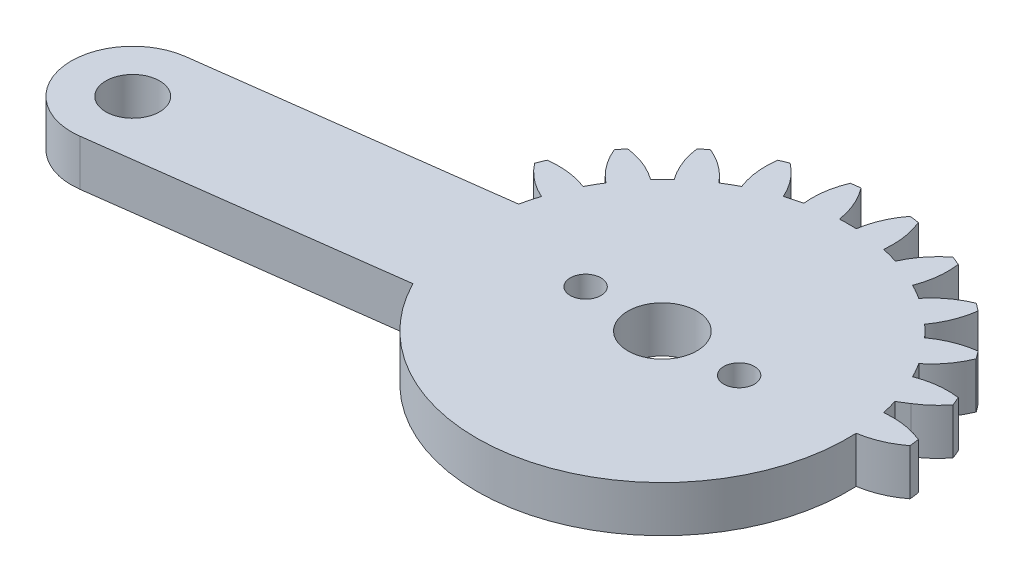
from build123d import *
from build123d.topology import SkipClean

# Parameters (mm, degrees)
SKETCH1_R           = 1.5
BOSS_EXTRUDE1_DEPTH = 3
SKETCH3_R           = 1.75
BOSS_EXTRUDE2_DEPTH = 3
CUT_EXTRUDE1_START  = -4
CUT_EXTRUDE1_DEPTH  = 4
CUT_EXTRUDE2_REACH  = 48.999
SKETCH5_R           = 1
SKETCH5_R_2         = 2.25


with BuildPart() as part:
    # Sketch1 → Boss-Extrude1 (new body)
    with BuildSketch(Plane(origin=(0, 0, 0), x_dir=(1, 0, 0), z_dir=(0, 1, 0))):
        with BuildLine():
            Line((20.643657446, 4), (2.081641936, 4))
            ThreePointArc((2.081641936, 4), (2.861028333, 4.588201733), (3.521749436, 5.30713988))
            ThreePointArc((3.521749436, 5.30713988), (3.405395609, 5.596745198), (3.282888305, 5.883801663))
            ThreePointArc((3.282888305, 5.883801663), (1.93527598, 5.894040025), (0.627094961, 5.57027124))
            ThreePointArc((0.627094961, 5.57027124), (0.366286148, 6.046375), (0.084372603, 6.510293938))
            ThreePointArc((0.084372603, 6.510293938), (1.018855105, 7.48132754), (1.683794586, 8.65351323))
            ThreePointArc((1.683794586, 8.65351323), (1.496450048, 8.903135899), (1.303821399, 9.148703928))
            ThreePointArc((1.303821399, 9.148703928), (-0.000522033, 8.809805691), (-1.180330337, 8.158486898))
            ThreePointArc((-1.180330337, 8.158486898), (-1.555477026, 8.550865528), (-1.947855656, 8.926012217))
            ThreePointArc((-1.947855656, 8.926012217), (-1.296536862, 10.105820521), (-0.957638625, 11.410163953))
            ThreePointArc((-0.957638625, 11.410163953), (-1.203206655, 11.602792602), (-1.452829324, 11.79013714))
            ThreePointArc((-1.452829324, 11.79013714), (-2.625015014, 11.125197659), (-3.596048616, 10.190715157))
            ThreePointArc((-3.596048616, 10.190715157), (-4.059967554, 10.472628702), (-4.536071314, 10.733437515))
            ThreePointArc((-4.536071314, 10.733437515), (-4.212302529, 12.041618533), (-4.222540891, 13.389230859))
            ThreePointArc((-4.222540891, 13.389230859), (-4.509597355, 13.511738163), (-4.799202674, 13.62809199))
            ThreePointArc((-4.799202674, 13.62809199), (-5.759348103, 12.682425791), (-6.455432668, 11.528463019))
            ThreePointArc((-6.455432668, 11.528463019), (-6.976508546, 11.680699536), (-7.503891752, 11.809396783))
            ThreePointArc((-7.503891752, 11.809396783), (-7.529737283, 13.156800143), (-7.888414517, 14.455843809))
            ThreePointArc((-7.888414517, 14.455843809), (-8.197396993, 14.499881098), (-8.507248835, 14.537314892))
            ThreePointArc((-8.507248835, 14.537314892), (-9.18992168, 13.375367565), (-9.563620196, 12.080565177))
            ThreePointArc((-9.563620196, 12.080565177), (-10.106342554, 12.09275), (-10.649064912, 12.080565177))
            ThreePointArc((-10.649064912, 12.080565177), (-11.022763428, 13.375367565), (-11.705436272, 14.537314892))
            ThreePointArc((-11.705436272, 14.537314892), (-12.015288115, 14.499881098), (-12.324270591, 14.455843809))
            ThreePointArc((-12.324270591, 14.455843809), (-12.682947825, 13.156800143), (-12.708793355, 11.809396783))
            ThreePointArc((-12.708793355, 11.809396783), (-13.236176561, 11.680699536), (-13.757252439, 11.528463019))
            ThreePointArc((-13.757252439, 11.528463019), (-14.453337005, 12.682425791), (-15.413482434, 13.62809199))
            ThreePointArc((-15.413482434, 13.62809199), (-15.703087752, 13.511738163), (-15.990144217, 13.389230859))
            ThreePointArc((-15.990144217, 13.389230859), (-16.000382579, 12.041618533), (-15.676613793, 10.733437515))
            ThreePointArc((-15.676613793, 10.733437515), (-16.152717554, 10.472628702), (-16.616636492, 10.190715157))
            ThreePointArc((-16.616636492, 10.190715157), (-17.587670094, 11.125197659), (-18.759855783, 11.79013714))
            ThreePointArc((-18.759855783, 11.79013714), (-19.009478453, 11.602792602), (-19.255046482, 11.410163953))
            ThreePointArc((-19.255046482, 11.410163953), (-18.916148245, 10.105820521), (-18.264829452, 8.926012217))
            ThreePointArc((-18.264829452, 8.926012217), (-18.657208082, 8.550865528), (-19.032354771, 8.158486898))
            ThreePointArc((-19.032354771, 8.158486898), (-20.212163074, 8.809805691), (-21.516506507, 9.148703928))
            ThreePointArc((-21.516506507, 9.148703928), (-21.709135156, 8.903135899), (-21.896479694, 8.65351323))
            ThreePointArc((-21.896479694, 8.65351323), (-21.231540213, 7.48132754), (-20.297057711, 6.510293938))
            ThreePointArc((-20.297057711, 6.510293938), (-20.578971255, 6.046375), (-20.839780068, 5.57027124))
            ThreePointArc((-20.839780068, 5.57027124), (-22.147961087, 5.894040025), (-23.495573413, 5.883801663))
            ThreePointArc((-23.495573413, 5.883801663), (-23.618080717, 5.596745198), (-23.734434544, 5.30713988))
            ThreePointArc((-23.734434544, 5.30713988), (-22.788768345, 4.346994451), (-21.634805572, 3.650909885))
            ThreePointArc((-21.634805572, 3.650909885), (-21.78704209, 3.129834008), (-21.915739337, 2.602450802))
            ThreePointArc((-21.915739337, 2.602450802), (-23.263142697, 2.576605271), (-24.562186363, 2.217928037))
            ThreePointArc((-24.562186363, 2.217928037), (-24.606223651, 1.908945561), (-24.643657446, 1.599093719))
            ThreePointArc((-24.643657446, 1.599093719), (-23.481710119, 0.916420874), (-22.186907731, 0.542722358))
            ThreePointArc((-22.186907731, 0.542722358), (-22.199092554, 0), (-22.186907731, -0.542722358))
            ThreePointArc((-22.186907731, -0.542722358), (-23.481710119, -0.916420874), (-24.643657446, -1.599093719))
            ThreePointArc((-24.643657446, -1.599093719), (-24.606223651, -1.908945561), (-24.562186363, -2.217928037))
            ThreePointArc((-24.562186363, -2.217928037), (-23.263142697, -2.576605271), (-21.915739337, -2.602450802))
            ThreePointArc((-21.915739337, -2.602450802), (-21.78704209, -3.129834008), (-21.634805572, -3.650909885))
            ThreePointArc((-21.634805572, -3.650909885), (-22.788768345, -4.346994451), (-23.734434544, -5.30713988))
            ThreePointArc((-23.734434544, -5.30713988), (-23.618080717, -5.596745198), (-23.495573413, -5.883801663))
            ThreePointArc((-23.495573413, -5.883801663), (-22.147961087, -5.894040025), (-20.839780068, -5.57027124))
            ThreePointArc((-20.839780068, -5.57027124), (-20.578971255, -6.046375), (-20.297057711, -6.510293938))
            ThreePointArc((-20.297057711, -6.510293938), (-21.231540213, -7.48132754), (-21.896479694, -8.65351323))
            ThreePointArc((-21.896479694, -8.65351323), (-21.709135156, -8.903135899), (-21.516506507, -9.148703928))
            ThreePointArc((-21.516506507, -9.148703928), (-20.212163074, -8.809805691), (-19.032354771, -8.158486898))
            ThreePointArc((-19.032354771, -8.158486898), (-18.657208082, -8.550865528), (-18.264829452, -8.926012217))
            ThreePointArc((-18.264829452, -8.926012217), (-18.916148245, -10.105820521), (-19.255046482, -11.410163953))
            ThreePointArc((-19.255046482, -11.410163953), (-19.009478453, -11.602792602), (-18.759855783, -11.79013714))
            ThreePointArc((-18.759855783, -11.79013714), (-17.587670094, -11.125197659), (-16.616636492, -10.190715157))
            ThreePointArc((-16.616636492, -10.190715157), (-16.152717554, -10.472628702), (-15.676613793, -10.733437515))
            ThreePointArc((-15.676613793, -10.733437515), (-16.000382579, -12.041618533), (-15.990144217, -13.389230859))
            ThreePointArc((-15.990144217, -13.389230859), (-15.703087752, -13.511738163), (-15.413482434, -13.62809199))
            ThreePointArc((-15.413482434, -13.62809199), (-14.453337005, -12.682425791), (-13.757252439, -11.528463019))
            ThreePointArc((-13.757252439, -11.528463019), (-13.236176561, -11.680699536), (-12.708793355, -11.809396783))
            ThreePointArc((-12.708793355, -11.809396783), (-12.682947825, -13.156800143), (-12.324270591, -14.455843809))
            ThreePointArc((-12.324270591, -14.455843809), (-12.015288115, -14.499881098), (-11.705436272, -14.537314892))
            ThreePointArc((-11.705436272, -14.537314892), (-11.022763428, -13.375367565), (-10.649064912, -12.080565177))
            ThreePointArc((-10.649064912, -12.080565177), (-10.106342554, -12.09275), (-9.563620196, -12.080565177))
            ThreePointArc((-9.563620196, -12.080565177), (-9.18992168, -13.375367565), (-8.507248835, -14.537314892))
            ThreePointArc((-8.507248835, -14.537314892), (-8.197396993, -14.499881098), (-7.888414517, -14.455843809))
            ThreePointArc((-7.888414517, -14.455843809), (-7.529737283, -13.156800143), (-7.503891752, -11.809396783))
            ThreePointArc((-7.503891752, -11.809396783), (-6.976508546, -11.680699536), (-6.455432668, -11.528463019))
            ThreePointArc((-6.455432668, -11.528463019), (-5.759348103, -12.682425791), (-4.799202674, -13.62809199))
            ThreePointArc((-4.799202674, -13.62809199), (-4.509597355, -13.511738163), (-4.222540891, -13.389230859))
            ThreePointArc((-4.222540891, -13.389230859), (-4.212302529, -12.041618533), (-4.536071314, -10.733437515))
            ThreePointArc((-4.536071314, -10.733437515), (-4.059967554, -10.472628702), (-3.596048616, -10.190715157))
            ThreePointArc((-3.596048616, -10.190715157), (-2.625015014, -11.125197659), (-1.452829324, -11.79013714))
            ThreePointArc((-1.452829324, -11.79013714), (-1.203206655, -11.602792602), (-0.957638625, -11.410163953))
            ThreePointArc((-0.957638625, -11.410163953), (-1.296536862, -10.105820521), (-1.947855656, -8.926012217))
            ThreePointArc((-1.947855656, -8.926012217), (-1.555477026, -8.550865528), (-1.180330337, -8.158486898))
            ThreePointArc((-1.180330337, -8.158486898), (-0.000522033, -8.809805691), (1.303821399, -9.148703928))
            ThreePointArc((1.303821399, -9.148703928), (1.496450048, -8.903135899), (1.683794586, -8.65351323))
            ThreePointArc((1.683794586, -8.65351323), (1.018855105, -7.48132754), (0.084372603, -6.510293938))
            ThreePointArc((0.084372603, -6.510293938), (0.366286148, -6.046375), (0.627094961, -5.57027124))
            ThreePointArc((0.627094961, -5.57027124), (1.93527598, -5.894040025), (3.282888305, -5.883801663))
            ThreePointArc((3.282888305, -5.883801663), (3.405395609, -5.596745198), (3.521749436, -5.30713988))
            ThreePointArc((3.521749436, -5.30713988), (2.861028333, -4.588201733), (2.081641936, -4))
            Line((2.081641936, -4), (20.643657446, -4))
            ThreePointArc((20.643657446, -4), (24.643657446, 0), (20.643657446, 4))
        make_face()
        with Locations(Location((-10.106342554, 0, 0), (0, 0, 270))):
            Circle(SKETCH1_R, mode=Mode.SUBTRACT)
        with Locations(Location((20.643657446, 0, 0), (0, 0, 270))):
            Circle(SKETCH1_R, mode=Mode.SUBTRACT)
    extrude(amount=BOSS_EXTRUDE1_DEPTH)

    # Sketch3 → Boss-Extrude2 (add)
    with BuildSketch(Plane(origin=(0, 3, 0), x_dir=(1, 0, 0), z_dir=(0, 1, 0))):
        with BuildLine():
            ThreePointArc((-9.584237785, -3.965779445), (-14.072121999, -0.522104769), (-10.628447323, 3.965779445))
            Line((-10.628447323, 3.965779445), (-41.11537681, -0.047900965))
            ThreePointArc((-41.11537681, -0.047900965), (-44.559051487, -4.53578518), (-40.071167272, -7.979459856))
            Line((-40.071167272, -7.979459856), (-9.584237785, -3.965779445))
        make_face()
        with Locations(Location((-40.593272041, -4.013680411, 0), (0, 0, 270))):
            Circle(SKETCH3_R, mode=Mode.SUBTRACT)
    extrude(amount=-BOSS_EXTRUDE2_DEPTH)

    # Sketch4 → Cut-Extrude1 (cut)
    with SkipClean():  # the faces are left unmerged after this step: merging them gives an invalid solid
        with BuildSketch(Plane(origin=(0, 3, 0), x_dir=(1, 0, 0), z_dir=(0, 1, 0)).offset(CUT_EXTRUDE1_START)):
            with BuildLine():
                ThreePointArc((20.643657446, -4), (24.643657446, 0), (20.643657446, 4))
                Line((20.643657446, 4), (2.081641936, 4))
                Line((2.081641936, 4), (1.43808022, 3.600125745))
                ThreePointArc((1.43808022, 3.600125745), (1.581217534, 3.104116905), (1.70305423, 2.602450802))
                ThreePointArc((1.70305423, 2.602450802), (3.050457589, 2.576605271), (4.349501255, 2.217928037))
                ThreePointArc((4.349501255, 2.217928037), (4.393538544, 1.908945561), (4.430972339, 1.599093719))
                ThreePointArc((4.430972339, 1.599093719), (3.269025011, 0.916420874), (1.974222624, 0.542722358))
                ThreePointArc((1.974222624, 0.542722358), (1.70305423, -2.602450802), (0.627094961, -5.57027124))
                ThreePointArc((0.627094961, -5.57027124), (1.93527598, -5.894040025), (3.282888305, -5.883801663))
                ThreePointArc((3.282888305, -5.883801663), (3.405395609, -5.596745198), (3.521749436, -5.30713988))
                ThreePointArc((3.521749436, -5.30713988), (2.861028333, -4.588201733), (2.081641936, -4))
                Line((2.081641936, -4), (20.643657446, -4))
            make_face()
            with BuildLine():
                ThreePointArc((1.683794586, -8.65351323), (1.018855105, -7.48132754), (0.084372603, -6.510293938))
                ThreePointArc((0.084372603, -6.510293938), (-0.512518948, -7.361599771), (-1.180330337, -8.158486898))
                ThreePointArc((-1.180330337, -8.158486898), (-0.000522033, -8.809805691), (1.303821399, -9.148703928))
                ThreePointArc((1.303821399, -9.148703928), (1.496450048, -8.903135899), (1.683794586, -8.65351323))
            make_face()
            with BuildLine():
                ThreePointArc((-0.957638625, -11.410163953), (-1.296536862, -10.105820521), (-1.947855656, -8.926012217))
                ThreePointArc((-1.947855656, -8.926012217), (-2.744742783, -9.593823606), (-3.596048616, -10.190715157))
                ThreePointArc((-3.596048616, -10.190715157), (-2.625015014, -11.125197659), (-1.452829324, -11.79013714))
                ThreePointArc((-1.452829324, -11.79013714), (-1.203206655, -11.602792602), (-0.957638625, -11.410163953))
            make_face()
            with BuildLine():
                ThreePointArc((-4.222540891, -13.389230859), (-4.212302529, -12.041618533), (-4.536071314, -10.733437515))
                ThreePointArc((-4.536071314, -10.733437515), (-5.478647477, -11.172244217), (-6.455432668, -11.528463019))
                ThreePointArc((-6.455432668, -11.528463019), (-5.759348103, -12.682425791), (-4.799202674, -13.62809199))
                ThreePointArc((-4.799202674, -13.62809199), (-4.509597355, -13.511738163), (-4.222540891, -13.389230859))
            make_face()
            with BuildLine():
                ThreePointArc((-7.888414517, -14.455843809), (-7.529737283, -13.156800143), (-7.503891752, -11.809396783))
                ThreePointArc((-7.503891752, -11.809396783), (-8.527921943, -11.989294847), (-9.563620196, -12.080565177))
                ThreePointArc((-9.563620196, -12.080565177), (-9.18992168, -13.375367565), (-8.507248835, -14.537314892))
                ThreePointArc((-8.507248835, -14.537314892), (-8.197396993, -14.499881098), (-7.888414517, -14.455843809))
            make_face()
            with BuildLine():
                ThreePointArc((-11.705436272, -14.537314892), (-11.022763428, -13.375367565), (-10.649064912, -12.080565177))
                ThreePointArc((-10.649064912, -12.080565177), (-11.684763165, -11.989294847), (-12.708793355, -11.809396783))
                ThreePointArc((-12.708793355, -11.809396783), (-12.682947825, -13.156800143), (-12.324270591, -14.455843809))
                ThreePointArc((-12.324270591, -14.455843809), (-12.015288115, -14.499881098), (-11.705436272, -14.537314892))
            make_face()
            with BuildLine():
                ThreePointArc((-15.413482434, -13.62809199), (-14.453337005, -12.682425791), (-13.757252439, -11.528463019))
                ThreePointArc((-13.757252439, -11.528463019), (-14.734037631, -11.172244217), (-15.676613793, -10.733437515))
                ThreePointArc((-15.676613793, -10.733437515), (-16.000382579, -12.041618533), (-15.990144217, -13.389230859))
                ThreePointArc((-15.990144217, -13.389230859), (-15.703087752, -13.511738163), (-15.413482434, -13.62809199))
            make_face()
            with BuildLine():
                ThreePointArc((-18.759855783, -11.79013714), (-17.587670094, -11.125197659), (-16.616636492, -10.190715157))
                ThreePointArc((-16.616636492, -10.190715157), (-17.467942324, -9.593823606), (-18.264829452, -8.926012217))
                ThreePointArc((-18.264829452, -8.926012217), (-18.916148245, -10.105820521), (-19.255046482, -11.410163953))
                ThreePointArc((-19.255046482, -11.410163953), (-19.009478453, -11.602792602), (-18.759855783, -11.79013714))
            make_face()
            with BuildLine():
                ThreePointArc((-21.516506507, -9.148703928), (-20.212163074, -8.809805691), (-19.032354771, -8.158486898))
                ThreePointArc((-19.032354771, -8.158486898), (-19.70016616, -7.361599771), (-20.297057711, -6.510293938))
                ThreePointArc((-20.297057711, -6.510293938), (-21.231540213, -7.48132754), (-21.896479694, -8.65351323))
                ThreePointArc((-21.896479694, -8.65351323), (-21.709135156, -8.903135899), (-21.516506507, -9.148703928))
            make_face()
            with BuildLine():
                ThreePointArc((-21.942853375, 2.47620963), (-21.92946485, 2.539366405), (-21.915739337, 2.602450802))
                ThreePointArc((-21.915739337, 2.602450802), (-23.263142697, 2.576605271), (-24.562186363, 2.217928037))
                ThreePointArc((-24.562186363, 2.217928037), (-24.56889027, 2.173784387), (-24.575459377, 2.129620475))
                Line((-24.575459377, 2.129620475), (-21.942853375, 2.47620963))
            make_face()
            with BuildLine():
                ThreePointArc((-23.495573413, -5.883801663), (-22.147961087, -5.894040025), (-20.839780068, -5.57027124))
                ThreePointArc((-20.839780068, -5.57027124), (-20.869365339, -5.512888815), (-20.898643838, -5.455349261))
                Line((-20.898643838, -5.455349261), (-23.531249839, -5.801938416))
                ThreePointArc((-23.531249839, -5.801938416), (-23.513474108, -5.842897269), (-23.495573413, -5.883801663))
            make_face()
        extrude(amount=CUT_EXTRUDE1_DEPTH, mode=Mode.SUBTRACT)

    # Sketch5 → Cut-Extrude2 (cut, up to next)
    with BuildSketch(Plane(origin=(0, 3, 0), x_dir=(1, 0, 0), z_dir=(0, 1, 0)), mode=Mode.PRIVATE) as cut_extrude2_sk1:
        with Locations(Location((-15.106342554, 0, 0), (0, 0, 270))):
            Circle(SKETCH5_R)
    cut_extrude2_tool1 = extrude(cut_extrude2_sk1.sketch, amount=-CUT_EXTRUDE2_REACH, mode=Mode.PRIVATE) & part.part
    # Sketch5 → Cut-Extrude2 (cut, up to next)
    with BuildSketch(Plane(origin=(0, 3, 0), x_dir=(1, 0, 0), z_dir=(0, 1, 0)), mode=Mode.PRIVATE) as cut_extrude2_sk2:
        with Locations(Location((-5.106342554, 0, 0), (0, 0, 270))):
            Circle(SKETCH5_R)
    cut_extrude2_tool2 = extrude(cut_extrude2_sk2.sketch, amount=-CUT_EXTRUDE2_REACH, mode=Mode.PRIVATE) & part.part
    # Sketch5 → Cut-Extrude2 (cut, up to next)
    with BuildSketch(Plane(origin=(0, 3, 0), x_dir=(1, 0, 0), z_dir=(0, 1, 0)), mode=Mode.PRIVATE) as cut_extrude2_sk3:
        with Locations(Location((-10.106342554, 0, 0), (0, 0, 270))):
            Circle(SKETCH5_R_2)
    cut_extrude2_tool3 = extrude(cut_extrude2_sk3.sketch, amount=-CUT_EXTRUDE2_REACH, mode=Mode.PRIVATE) & part.part
    add(cut_extrude2_tool1.solids().sort_by_distance((-15.106343, 3, 0))[0], mode=Mode.SUBTRACT)
    add(cut_extrude2_tool2.solids().sort_by_distance((-5.106343, 3, 0))[0], mode=Mode.SUBTRACT)
    add(cut_extrude2_tool3.solids().sort_by_distance((-10.106343, 3, 0))[0], mode=Mode.SUBTRACT)


solid = part.part
